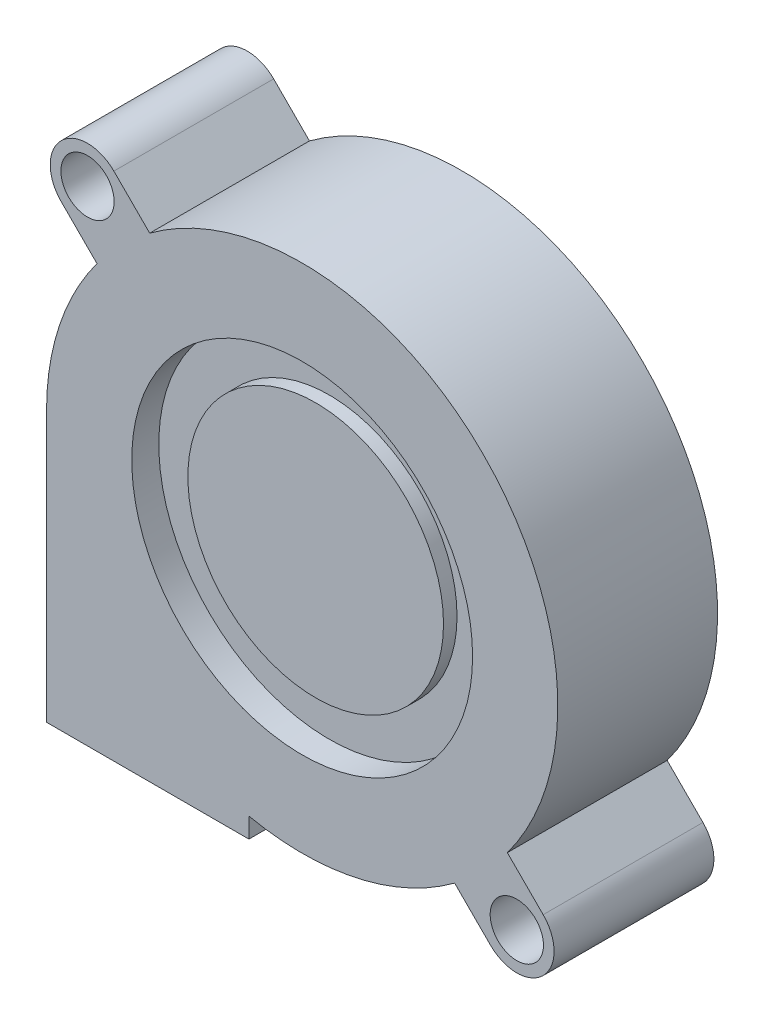
from build123d import *

# Parameters (mm, degrees)
BOSS_EXTRUDE1_DEPTH = 15
SKETCH2_W           = 16.6
SKETCH2_H           = 12.6
CUT_EXTRUDE1_DEPTH  = 4
SKETCH3_R           = 16
SKETCH3_R_2         = 12
CUT_EXTRUDE2_DEPTH  = 2.54
SKETCH4_R           = 12
CUT_EXTRUDE3_DEPTH  = 1.27


with BuildPart() as part:
    # Sketch1 → Boss-Extrude1 (new body)
    with BuildSketch(Plane.XY):
        with BuildLine():
            ThreePointArc((-5, -23.473389189), (-18.654758106, -15.099668871), (-24, 0))
            Line((-24, 0), (-24, -25.347456736))
            Line((-24, -25.347456736), (-5, -25.347456736))
            Line((-5, -25.347456736), (-5, -23.473389189))
        make_face()
        with BuildLine():
            Line((-4.949747468, 0), (-19.264007125, 14.314259656))
            ThreePointArc((-19.264007125, 14.314259656), (-22.785260268, 7.538694483), (-24, 0))
            Line((-24, 0), (-4.949747468, 0))
        make_face()
        with BuildLine():
            Line((14.314259656, -19.264007125), (-4.949747468, 0))
            Line((-4.949747468, 0), (-24, 0))
            ThreePointArc((-24, 0), (-18.654758106, -15.099668871), (-5, -23.473389189))
            ThreePointArc((-5, -23.473389189), (5.110634264, -23.449550474), (14.314259656, -19.264007125))
        make_face()
        with BuildLine():
            Line((-4.949747468, 0), (-19.264007125, 14.314259656))
            ThreePointArc((-19.264007125, 14.314259656), (-22.785260268, 7.538694483), (-24, 0))
            Line((-24, 0), (-4.949747468, 0))
        make_face()
        with BuildLine():
            Line((14.314259656, -19.264007125), (-4.949747468, 0))
            Line((-4.949747468, 0), (-24, 0))
            ThreePointArc((-24, 0), (-18.654758106, -15.099668871), (-5, -23.473389189))
            ThreePointArc((-5, -23.473389189), (5.110634264, -23.449550474), (14.314259656, -19.264007125))
        make_face()
        with BuildLine():
            Line((0, 0), (-16.970562748, 16.970562748))
            ThreePointArc((-16.970562748, 16.970562748), (-18.165902125, 15.684387141), (-19.264007125, 14.314259656))
            Line((-19.264007125, 14.314259656), (-4.949747468, 0))
            Line((-4.949747468, 0), (0, 0))
        make_face()
        with BuildLine():
            Line((16.970562748, -16.970562748), (0, 0))
            Line((0, 0), (-4.949747468, 0))
            Line((-4.949747468, 0), (14.314259656, -19.264007125))
            ThreePointArc((14.314259656, -19.264007125), (15.684387141, -18.165902125), (16.970562748, -16.970562748))
        make_face()
        with BuildLine():
            ThreePointArc((-14.314259656, 19.264007125), (-15.684387141, 18.165902125), (-16.970562748, 16.970562748))
            Line((-16.970562748, 16.970562748), (0, 0))
            Line((0, 0), (16.970562748, -16.970562748))
            ThreePointArc((16.970562748, -16.970562748), (18.165902125, -15.684387141), (19.264007125, -14.314259656))
            Line((19.264007125, -14.314259656), (-14.314259656, 19.264007125))
        make_face()
        with BuildLine():
            ThreePointArc((24, 0), (10.780950057, 21.442274037), (-14.314259656, 19.264007125))
            Line((-14.314259656, 19.264007125), (19.264007125, -14.314259656))
            ThreePointArc((19.264007125, -14.314259656), (22.785260268, -7.538694483), (24, 0))
        make_face()
        with BuildLine():
            Line((-16.970562748, 16.970562748), (-17.67766953, 17.67766953))
            ThreePointArc((-17.67766953, 17.67766953), (-20.152543264, 16.652543264), (-22.627416998, 17.67766953))
            Line((-22.627416998, 17.67766953), (-19.264007125, 14.314259656))
            ThreePointArc((-19.264007125, 14.314259656), (-18.165902125, 15.684387141), (-16.970562748, 16.970562748))
        make_face()
        with BuildLine():
            ThreePointArc((-16.652543264, 20.152543264), (-16.9189649, 18.813151251), (-17.67766953, 17.67766953))
            Line((-17.67766953, 17.67766953), (-16.970562748, 16.970562748))
            ThreePointArc((-16.970562748, 16.970562748), (-15.684387141, 18.165902125), (-14.314259656, 19.264007125))
            Line((-14.314259656, 19.264007125), (-17.67766953, 22.627416998))
            ThreePointArc((-17.67766953, 22.627416998), (-16.9189649, 21.491935277), (-16.652543264, 20.152543264))
        make_face()
        with BuildLine():
            ThreePointArc((23.652543264, -20.152543264), (23.386121628, -18.813151251), (22.627416998, -17.67766953))
            Line((22.627416998, -17.67766953), (21.920310217, -18.384776311))
            ThreePointArc((21.920310217, -18.384776311), (22.462242095, -19.195834683), (22.652543264, -20.152543264))
            ThreePointArc((22.652543264, -20.152543264), (22.462242095, -21.109251845), (21.920310217, -21.920310217))
            Line((21.920310217, -21.920310217), (22.627416998, -22.627416998))
            ThreePointArc((22.627416998, -22.627416998), (23.386121628, -21.491935277), (23.652543264, -20.152543264))
        make_face()
        with BuildLine():
            Line((21.920310217, -18.384776311), (22.627416998, -17.67766953))
            ThreePointArc((22.627416998, -17.67766953), (20.152543264, -16.652543264), (17.67766953, -17.67766953))
            Line((17.67766953, -17.67766953), (18.384776311, -18.384776311))
            ThreePointArc((18.384776311, -18.384776311), (20.152543264, -17.652543264), (21.920310217, -18.384776311))
        make_face()
        with BuildLine():
            Line((18.384776311, -18.384776311), (17.67766953, -17.67766953))
            ThreePointArc((17.67766953, -17.67766953), (16.652543264, -20.152543264), (17.67766953, -22.627416998))
            Line((17.67766953, -22.627416998), (18.384776311, -21.920310217))
            ThreePointArc((18.384776311, -21.920310217), (17.652543264, -20.152543264), (18.384776311, -18.384776311))
        make_face()
        with BuildLine():
            Line((18.384776311, -21.920310217), (17.67766953, -22.627416998))
            ThreePointArc((17.67766953, -22.627416998), (20.152543264, -23.652543264), (22.627416998, -22.627416998))
            Line((22.627416998, -22.627416998), (21.920310217, -21.920310217))
            ThreePointArc((21.920310217, -21.920310217), (20.152543264, -22.652543264), (18.384776311, -21.920310217))
        make_face()
        with BuildLine():
            ThreePointArc((23.652543264, -20.152543264), (23.386121628, -18.813151251), (22.627416998, -17.67766953))
            Line((22.627416998, -17.67766953), (21.920310217, -18.384776311))
            ThreePointArc((21.920310217, -18.384776311), (22.462242095, -19.195834683), (22.652543264, -20.152543264))
            ThreePointArc((22.652543264, -20.152543264), (22.462242095, -21.109251845), (21.920310217, -21.920310217))
            Line((21.920310217, -21.920310217), (22.627416998, -22.627416998))
            ThreePointArc((22.627416998, -22.627416998), (23.386121628, -21.491935277), (23.652543264, -20.152543264))
        make_face()
        with BuildLine():
            Line((21.920310217, -18.384776311), (22.627416998, -17.67766953))
            ThreePointArc((22.627416998, -17.67766953), (20.152543264, -16.652543264), (17.67766953, -17.67766953))
            Line((17.67766953, -17.67766953), (18.384776311, -18.384776311))
            ThreePointArc((18.384776311, -18.384776311), (20.152543264, -17.652543264), (21.920310217, -18.384776311))
        make_face()
        with BuildLine():
            Line((18.384776311, -18.384776311), (17.67766953, -17.67766953))
            ThreePointArc((17.67766953, -17.67766953), (16.652543264, -20.152543264), (17.67766953, -22.627416998))
            Line((17.67766953, -22.627416998), (18.384776311, -21.920310217))
            ThreePointArc((18.384776311, -21.920310217), (17.652543264, -20.152543264), (18.384776311, -18.384776311))
        make_face()
        with BuildLine():
            Line((18.384776311, -21.920310217), (17.67766953, -22.627416998))
            ThreePointArc((17.67766953, -22.627416998), (20.152543264, -23.652543264), (22.627416998, -22.627416998))
            Line((22.627416998, -22.627416998), (21.920310217, -21.920310217))
            ThreePointArc((21.920310217, -21.920310217), (20.152543264, -22.652543264), (18.384776311, -21.920310217))
        make_face()
        with BuildLine():
            Line((17.67766953, -17.67766953), (16.970562748, -16.970562748))
            ThreePointArc((16.970562748, -16.970562748), (15.684387141, -18.165902125), (14.314259656, -19.264007125))
            Line((14.314259656, -19.264007125), (17.67766953, -22.627416998))
            ThreePointArc((17.67766953, -22.627416998), (16.652543264, -20.152543264), (17.67766953, -17.67766953))
        make_face()
        with BuildLine():
            Line((22.627416998, -17.67766953), (19.264007125, -14.314259656))
            ThreePointArc((19.264007125, -14.314259656), (18.165902125, -15.684387141), (16.970562748, -16.970562748))
            Line((16.970562748, -16.970562748), (17.67766953, -17.67766953))
            ThreePointArc((17.67766953, -17.67766953), (20.152543264, -16.652543264), (22.627416998, -17.67766953))
        make_face()
        with BuildLine():
            ThreePointArc((23.652543264, -20.152543264), (23.386121628, -18.813151251), (22.627416998, -17.67766953))
            Line((22.627416998, -17.67766953), (21.920310217, -18.384776311))
            ThreePointArc((21.920310217, -18.384776311), (22.462242095, -19.195834683), (22.652543264, -20.152543264))
            ThreePointArc((22.652543264, -20.152543264), (22.462242095, -21.109251845), (21.920310217, -21.920310217))
            Line((21.920310217, -21.920310217), (22.627416998, -22.627416998))
            ThreePointArc((22.627416998, -22.627416998), (23.386121628, -21.491935277), (23.652543264, -20.152543264))
        make_face()
        with BuildLine():
            Line((21.920310217, -18.384776311), (22.627416998, -17.67766953))
            ThreePointArc((22.627416998, -17.67766953), (20.152543264, -16.652543264), (17.67766953, -17.67766953))
            Line((17.67766953, -17.67766953), (18.384776311, -18.384776311))
            ThreePointArc((18.384776311, -18.384776311), (20.152543264, -17.652543264), (21.920310217, -18.384776311))
        make_face()
        with BuildLine():
            Line((18.384776311, -18.384776311), (17.67766953, -17.67766953))
            ThreePointArc((17.67766953, -17.67766953), (16.652543264, -20.152543264), (17.67766953, -22.627416998))
            Line((17.67766953, -22.627416998), (18.384776311, -21.920310217))
            ThreePointArc((18.384776311, -21.920310217), (17.652543264, -20.152543264), (18.384776311, -18.384776311))
        make_face()
        with BuildLine():
            Line((18.384776311, -21.920310217), (17.67766953, -22.627416998))
            ThreePointArc((17.67766953, -22.627416998), (20.152543264, -23.652543264), (22.627416998, -22.627416998))
            Line((22.627416998, -22.627416998), (21.920310217, -21.920310217))
            ThreePointArc((21.920310217, -21.920310217), (20.152543264, -22.652543264), (18.384776311, -21.920310217))
        make_face()
        with BuildLine():
            ThreePointArc((23.652543264, -20.152543264), (23.386121628, -18.813151251), (22.627416998, -17.67766953))
            Line((22.627416998, -17.67766953), (21.920310217, -18.384776311))
            ThreePointArc((21.920310217, -18.384776311), (22.462242095, -19.195834683), (22.652543264, -20.152543264))
            ThreePointArc((22.652543264, -20.152543264), (22.462242095, -21.109251845), (21.920310217, -21.920310217))
            Line((21.920310217, -21.920310217), (22.627416998, -22.627416998))
            ThreePointArc((22.627416998, -22.627416998), (23.386121628, -21.491935277), (23.652543264, -20.152543264))
        make_face()
        with BuildLine():
            Line((21.920310217, -18.384776311), (22.627416998, -17.67766953))
            ThreePointArc((22.627416998, -17.67766953), (20.152543264, -16.652543264), (17.67766953, -17.67766953))
            Line((17.67766953, -17.67766953), (18.384776311, -18.384776311))
            ThreePointArc((18.384776311, -18.384776311), (20.152543264, -17.652543264), (21.920310217, -18.384776311))
        make_face()
        with BuildLine():
            Line((18.384776311, -18.384776311), (17.67766953, -17.67766953))
            ThreePointArc((17.67766953, -17.67766953), (16.652543264, -20.152543264), (17.67766953, -22.627416998))
            Line((17.67766953, -22.627416998), (18.384776311, -21.920310217))
            ThreePointArc((18.384776311, -21.920310217), (17.652543264, -20.152543264), (18.384776311, -18.384776311))
        make_face()
        with BuildLine():
            Line((18.384776311, -21.920310217), (17.67766953, -22.627416998))
            ThreePointArc((17.67766953, -22.627416998), (20.152543264, -23.652543264), (22.627416998, -22.627416998))
            Line((22.627416998, -22.627416998), (21.920310217, -21.920310217))
            ThreePointArc((21.920310217, -21.920310217), (20.152543264, -22.652543264), (18.384776311, -21.920310217))
        make_face()
        with BuildLine():
            ThreePointArc((-21.920310217, 18.384776311), (-22.652543264, 20.152543264), (-21.920310217, 21.920310217))
            Line((-21.920310217, 21.920310217), (-22.627416998, 22.627416998))
            ThreePointArc((-22.627416998, 22.627416998), (-23.652543264, 20.152543264), (-22.627416998, 17.67766953))
            Line((-22.627416998, 17.67766953), (-21.920310217, 18.384776311))
        make_face()
        with BuildLine():
            Line((-17.67766953, 17.67766953), (-18.384776311, 18.384776311))
            ThreePointArc((-18.384776311, 18.384776311), (-20.152543264, 17.652543264), (-21.920310217, 18.384776311))
            Line((-21.920310217, 18.384776311), (-22.627416998, 17.67766953))
            ThreePointArc((-22.627416998, 17.67766953), (-20.152543264, 16.652543264), (-17.67766953, 17.67766953))
        make_face()
        with BuildLine():
            Line((-22.627416998, 22.627416998), (-21.920310217, 21.920310217))
            ThreePointArc((-21.920310217, 21.920310217), (-19.195834683, 22.462242095), (-17.652543264, 20.152543264))
            ThreePointArc((-17.652543264, 20.152543264), (-17.842844433, 19.195834683), (-18.384776311, 18.384776311))
            Line((-18.384776311, 18.384776311), (-17.67766953, 17.67766953))
            ThreePointArc((-17.67766953, 17.67766953), (-16.9189649, 18.813151251), (-16.652543264, 20.152543264))
            ThreePointArc((-16.652543264, 20.152543264), (-16.9189649, 21.491935277), (-17.67766953, 22.627416998))
            ThreePointArc((-17.67766953, 22.627416998), (-20.152543264, 23.652543264), (-22.627416998, 22.627416998))
        make_face()
        with BuildLine():
            ThreePointArc((-21.920310217, 18.384776311), (-22.652543264, 20.152543264), (-21.920310217, 21.920310217))
            Line((-21.920310217, 21.920310217), (-22.627416998, 22.627416998))
            ThreePointArc((-22.627416998, 22.627416998), (-23.652543264, 20.152543264), (-22.627416998, 17.67766953))
            Line((-22.627416998, 17.67766953), (-21.920310217, 18.384776311))
        make_face()
        with BuildLine():
            Line((-17.67766953, 17.67766953), (-18.384776311, 18.384776311))
            ThreePointArc((-18.384776311, 18.384776311), (-20.152543264, 17.652543264), (-21.920310217, 18.384776311))
            Line((-21.920310217, 18.384776311), (-22.627416998, 17.67766953))
            ThreePointArc((-22.627416998, 17.67766953), (-20.152543264, 16.652543264), (-17.67766953, 17.67766953))
        make_face()
    extrude(amount=BOSS_EXTRUDE1_DEPTH)

    # Sketch2 → Cut-Extrude1 (cut)
    with BuildSketch(Plane.XZ.offset(25.347456736)):
        with Locations((-14.5, 7.5)):
            Rectangle(SKETCH2_W, SKETCH2_H)
    extrude(amount=-CUT_EXTRUDE1_DEPTH, mode=Mode.SUBTRACT)

    # Sketch3 → Cut-Extrude2 (cut)
    with BuildSketch(Plane.XY.offset(15)):
        Circle(SKETCH3_R)
        Circle(SKETCH3_R_2, mode=Mode.SUBTRACT)
    extrude(amount=-CUT_EXTRUDE2_DEPTH, mode=Mode.SUBTRACT)

    # Sketch4 → Cut-Extrude3 (cut)
    with BuildSketch(Plane.XY.offset(15)):
        Circle(SKETCH4_R)
    extrude(amount=-CUT_EXTRUDE3_DEPTH, mode=Mode.SUBTRACT)


solid = part.part
